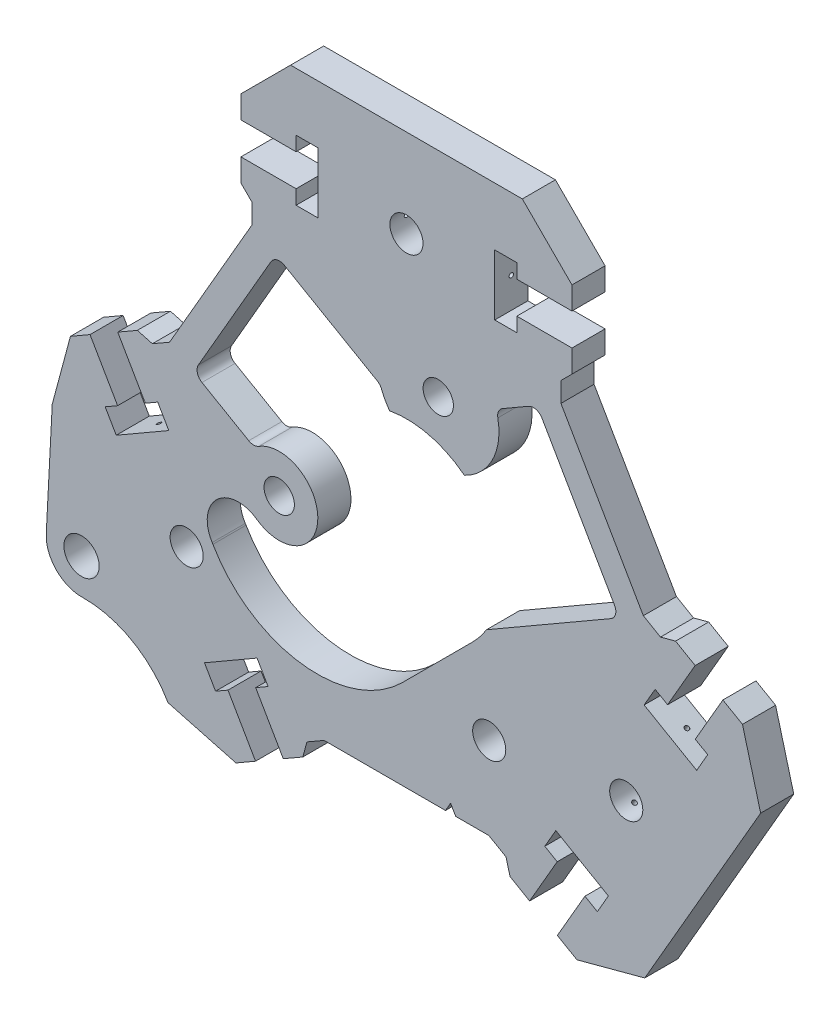
from build123d import *

# Parameters (mm, degrees)
SKETCH1_R           = 1.5
BOSS_EXTRUDE1_DEPTH = 3
SKETCH2_R           = 0.2
CUT_EXTRUDE1_DEPTH  = 51.771570482
CIRPATTERN1_COUNT   = 3
SKETCH3_R           = 8.5
CUT_EXTRUDE2_DEPTH  = 45.723637705
SKETCH4_R           = 1.5
SKETCH4_R_2         = 1.375
CUT_EXTRUDE3_DEPTH  = 45.723637705
CUT_EXTRUDE6_DEPTH  = 45.723637705
SKETCH10_R          = 1.6
BOSS_EXTRUDE3_DEPTH = 3
CUT_EXTRUDE7_DEPTH  = 46.118589611


with BuildPart() as part:
    # Sketch1 → Boss-Extrude1 (new body)
    with BuildSketch(Plane.XY):
        Polygon((8, 23), (8, 25.75), (10, 25.75), (10, 24.45), (15, 24.45), (15, 26.5), (10.5, 31), (-10.5, 31), (-15, 26.5), (-15, 24.45), (-10, 24.45), (-10, 25.75), (-8, 25.75), (-8, 23), (-8, 20.25), (-10, 20.25), (-10, 21.55), (-15, 21.55), (-15, 19.5), (-14, 18.5), (-14, 16.703779947), (-17.732948887, 10.238122813), (-21.465897773, 3.772465679), (-23.02146997, 2.874355653), (-24.387495374, 3.240381057), (-26.162847452, 2.215381057), (-23.662847452, -2.114745962), (-22.537014427, -1.464745962), (-21.537014427, -3.19679677), (-23.918584287, -4.57179677), (-26.300154147, -5.94679677), (-27.300154147, -4.214745962), (-26.174321123, -3.564745962), (-28.674321123, 0.765381057), (-30.4496732, -0.259618943), (-32.096787517, -6.40673326), (-21.596787517, -24.59326674), (-15.4496732, -26.240381057), (-13.674321123, -25.215381057), (-16.174321123, -20.885254038), (-17.300154147, -21.535254038), (-18.300154147, -19.80320323), (-15.918584287, -18.42820323), (-13.537014427, -17.05320323), (-12.537014427, -18.785254038), (-13.662847452, -19.435254038), (-11.162847452, -23.765381057), (-9.387495374, -22.740381057), (-9.02146997, -21.374355653), (-7.465897773, -20.476245627), (0, -20.476245627), (7.465897773, -20.476245627), (9.02146997, -21.374355653), (9.387495374, -22.740381057), (11.162847452, -23.765381057), (13.662847452, -19.435254038), (12.537014427, -18.785254038), (13.537014427, -17.05320323), (15.918584287, -18.42820323), (18.300154147, -19.80320323), (17.300154147, -21.535254038), (16.174321123, -20.885254038), (13.674321123, -25.215381057), (15.4496732, -26.240381057), (21.596787517, -24.59326674), (32.096787517, -6.40673326), (30.4496732, -0.259618943), (28.674321123, 0.765381057), (26.174321123, -3.564745962), (27.300154147, -4.214745962), (26.300154147, -5.94679677), (23.918584287, -4.57179677), (21.537014427, -3.19679677), (22.537014427, -1.464745962), (23.662847452, -2.114745962), (26.162847452, 2.215381057), (24.387495374, 3.240381057), (23.02146997, 2.874355653), (21.465897773, 3.772465679), (17.732948887, 10.238122813), (14, 16.703779947), (14, 18.5), (15, 19.5), (15, 21.55), (10, 21.55), (10, 20.25), (8, 20.25), align=None)
        with Locations((0, 23)):
            Circle(SKETCH1_R, mode=Mode.SUBTRACT)
        with Locations((19.918584287, -11.5)):
            Circle(SKETCH1_R, mode=Mode.SUBTRACT)
        with Locations((-19.918584287, -11.5)):
            Circle(SKETCH1_R, mode=Mode.SUBTRACT)
    extrude(amount=BOSS_EXTRUDE1_DEPTH)

    # Sketch2 → Cut-Extrude1 (cut, through all)
    with BuildSketch(Plane(origin=(8, 0, 0), x_dir=(0, 0, -1), z_dir=(1, 0, 0))):
        with Locations(Location((-1.5, 23, 0), (0, 0, 90))):
            Circle(SKETCH2_R)
    cut_extrude1 = extrude(amount=-CUT_EXTRUDE1_DEPTH, mode=Mode.SUBTRACT)

    # CirPattern1: Cut-Extrude1 ×3 about axis
    cirpattern1_axis = Axis((0, 0, -0.25), (0, 0, 1))
    for i in range(1, CIRPATTERN1_COUNT):
        add(cut_extrude1.rotate(cirpattern1_axis, i * 360 / CIRPATTERN1_COUNT), mode=Mode.SUBTRACT)

    # Sketch3 → Cut-Extrude2 (cut, through all)
    with BuildSketch(Plane.XY.offset(3)):
        Circle(SKETCH3_R)
    extrude(amount=-CUT_EXTRUDE2_DEPTH, mode=Mode.SUBTRACT)

    # Sketch4 → Cut-Extrude3 (cut, through all)
    with BuildSketch(Plane.XY.offset(3)):
        with Locations((7.5, -12.990381057)):
            Circle(SKETCH4_R)
        with Locations((-11.529543503, -3.327104841)):
            Circle(SKETCH4_R_2)
        with Locations((2.883414438, 11.648429988)):
            Circle(SKETCH4_R_2)
    extrude(amount=-CUT_EXTRUDE3_DEPTH, mode=Mode.SUBTRACT)

    # Sketch8 → Cut-Extrude6 (cut, through all)
    with BuildSketch(Plane(origin=(0, 0, 0), x_dir=(-1, 0, 0), z_dir=(0, 0, -1))):
        with BuildLine():
            Line((12.279936491, 14.683017338), (18.855834264, 3.293228289))
            ThreePointArc((18.855834264, 3.293228289), (18.94474564, 2.617879339), (18.530071655, 2.077465679))
            Line((18.530071655, 2.077465679), (14.291991324, -0.36939114))
            ThreePointArc((14.291991324, -0.36939114), (13.832521283, -0.488510893), (13.377167051, -0.354515528))
            ThreePointArc((13.377167051, -0.354515528), (8.03139394, -3.440901304), (13.566455789, -6.173328363))
            ThreePointArc((13.566455789, -6.173328363), (17.172799511, -6.424627154), (17.604766052, -10.013815228))
            ThreePointArc((17.604766052, -10.013815228), (17.57023213, -10.069006588), (17.537014427, -10.125))
            ThreePointArc((17.537014427, -10.125), (9.508411975, -15.48954065), (0.36493223, -12.38574751))
            Line((0.36493223, -12.38574751), (-6.01040764, -6.01040764))
            ThreePointArc((-6.01040764, -6.01040764), (-6.677816527, -5.258970093), (-7.251866025, -4.434009377))
            Line((-7.251866025, -4.434009377), (-18.530071655, 2.077465679))
            ThreePointArc((-18.530071655, 2.077465679), (-18.94474564, 2.617879339), (-18.855834264, 3.293228289))
            Line((-18.855834264, 3.293228289), (-12.279936491, 14.683017338))
            ThreePointArc((-12.279936491, 14.683017338), (-11.739522831, 15.097691323), (-11.064173881, 15.008779947))
            Line((-11.064173881, 15.008779947), (-8.70895574, 13.648994119))
            ThreePointArc((-8.70895574, 13.648994119), (-8.343780593, 13.24662835), (-8.280593962, 12.7069446))
            ThreePointArc((-8.280593962, 12.7069446), (-7.79681587, 9.176894763), (-5.250985835, 6.68409663))
            ThreePointArc((-5.250985835, 6.68409663), (-2.04241856, 8.250971241), (1.526575519, 8.361792104))
            ThreePointArc((1.526575519, 8.361792104), (1.938099301, 9.002110796), (2.257279563, 9.69311283))
            ThreePointArc((2.257279563, 9.69311283), (2.411493279, 9.95368058), (2.644137319, 10.147469572))
            Line((2.644137319, 10.147469572), (11.064173881, 15.008779947))
            ThreePointArc((11.064173881, 15.008779947), (11.739522831, 15.097691323), (12.279936491, 14.683017338))
        make_face()
    extrude(amount=-CUT_EXTRUDE6_DEPTH, mode=Mode.SUBTRACT)

    # Sketch10 → Boss-Extrude3 (add, through all)
    with BuildSketch(Plane(origin=(0, 0, 0), x_dir=(-1, 0, 0), z_dir=(0, 0, -1))):
        with BuildLine():
            Line((32.096787517, -6.40673326), (32.640521415, -16.833350806))
            ThreePointArc((32.640521415, -16.833350806), (31.744101835, -19.225646902), (29.382221383, -20.199386806))
            ThreePointArc((29.382221383, -20.199386806), (24.889296585, -21.332829657), (21.596787517, -24.59326674))
            Line((21.596787517, -24.59326674), (32.096787517, -6.40673326))
        make_face()
        with Locations((29.444863729, -17)):
            Circle(SKETCH10_R, mode=Mode.SUBTRACT)
    extrude(amount=-BOSS_EXTRUDE3_DEPTH)

    # Sketch11 → Cut-Extrude7 (cut, through all)
    with BuildSketch(Plane(origin=(0, 0, 0), x_dir=(-1, 0, 0), z_dir=(0, 0, -1))):
        Polygon((-4.461880215, -20.476245627), (-3.538119785, -20.476245627), (-4, -19.676245627), align=None)
    extrude(amount=-CUT_EXTRUDE7_DEPTH, mode=Mode.SUBTRACT)


solid = part.part
